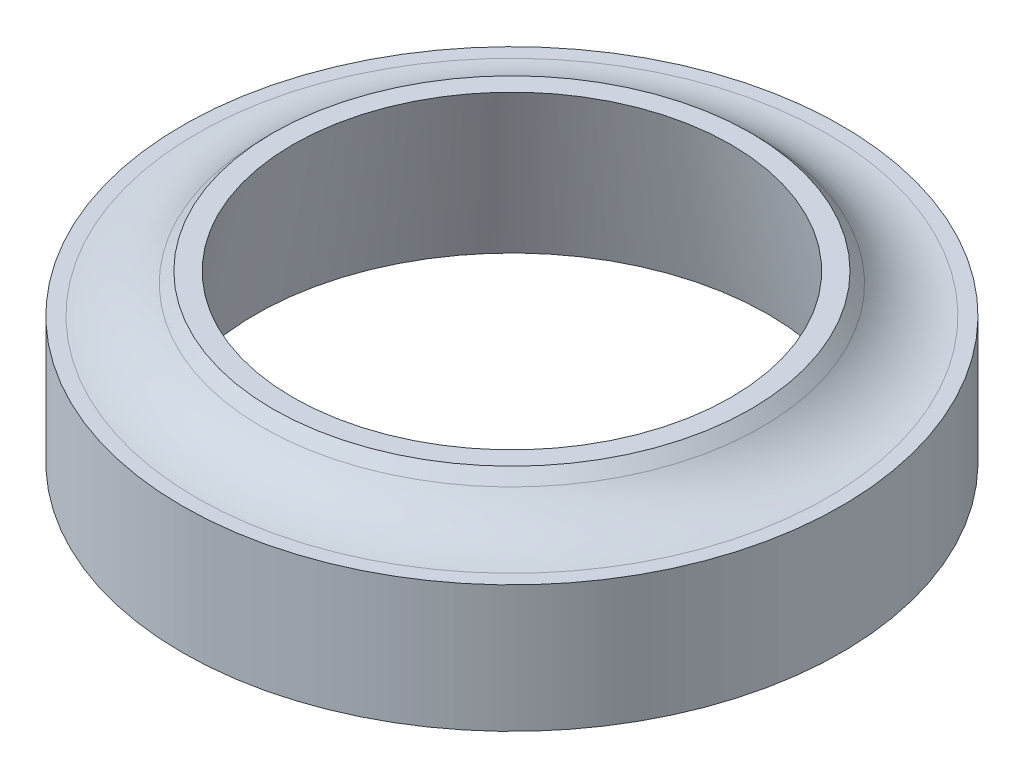
from build123d import *

# Parameters (mm, degrees)
REDONDEO1_R = 2.5


with BuildPart() as part:
    # Croquis1 → Revolución1 (revolve)
    with BuildSketch(Plane.XY, mode=Mode.PRIVATE) as revoluci_n1_sk:
        Polygon((-7, 0.014889516), (-5.98143128, 4.539027855), (-6.528856455, 4.539027855), (-7.548007417, 3.479790211), (-9, 3.479790211), (-9, 0.014889516), align=None)
    revolve(revoluci_n1_sk.sketch.rotate(Axis((0, 13.059059278, 0), (0, -1, 0)), 270), axis=Axis((0, 13.059059278, 0), (0, -1, 0)))

    # Redondeo1
    redondeo1_edges = [part.edges().sort_by_distance(p)[0] for p in [
        (0, 3.479790211, -7.548007417),
    ]]
    fillet(redondeo1_edges, radius=REDONDEO1_R)


solid = part.part
